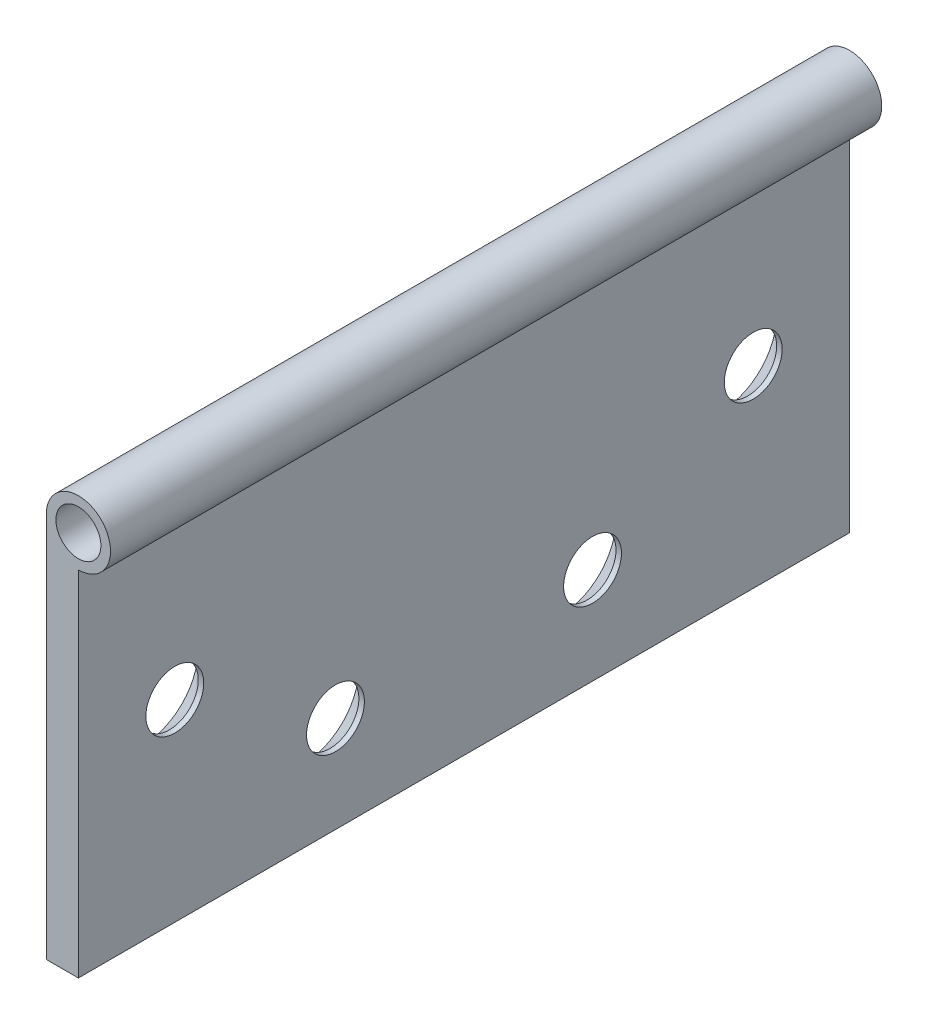
from build123d import *

# Parameters (mm, degrees)
SKETCH_1_W                  = 5
SKETCH_1_H                  = 60
EXTRUDE_2_DEPTH             = 60
SKETCH_2_R                  = 5
SKETCH_3_R                  = 3.5
CUT_EXTRUDE_1_DEPTH         = 137.839321834
HOLE_WIZARD_M81_D           = 9
HOLE_WIZARD_M81_CSINK_D     = 17.3
HOLE_WIZARD_M81_CSINK_ANGLE = 90


with BuildPart() as part:
    # Эскиз1 → Вытянуть-Тонкостенный2 (new, symmetric)
    with BuildSketch(Plane.XY):
        with Locations((2.5, 30)):
            Rectangle(SKETCH_1_W, SKETCH_1_H)
    extrude(amount=EXTRUDE_2_DEPTH, both=True)

    # По траектории1: sweep along a curve in space
    with BuildLine() as sweep_1_path:
        Line((0, 60, 60), (0, 60, -60))
    # Эскиз2 → По траектории1 (sweep)
    with BuildSketch(Plane.XY.offset(60)):
        with Locations((5, 60)):
            Circle(SKETCH_2_R)
    sweep(path=sweep_1_path.line)

    # Эскиз3 → Вырез-Вытянуть1 (cut, through all)
    with BuildSketch(Plane.XY.offset(60)):
        with Locations((5, 60)):
            Circle(SKETCH_3_R)
    extrude(amount=-CUT_EXTRUDE_1_DEPTH, mode=Mode.SUBTRACT)

    # Зенковка для  винта с плоской головкой M81 (through all)
    with Locations(Plane(origin=(0, 0, 0), x_dir=(0, 0, -1), z_dir=(-1, 0, 0))):
        with Locations((-45, -30), (-20, -15)):
            hole_wizard_m81 = CounterSinkHole(HOLE_WIZARD_M81_D / 2, HOLE_WIZARD_M81_CSINK_D / 2, counter_sink_angle=HOLE_WIZARD_M81_CSINK_ANGLE)

    # Зеркальное отражение4: Зенковка для  винта с плоской головкой M81 across plane
    add(hole_wizard_m81.mirror(Plane.XY), mode=Mode.SUBTRACT)


solid = part.part
